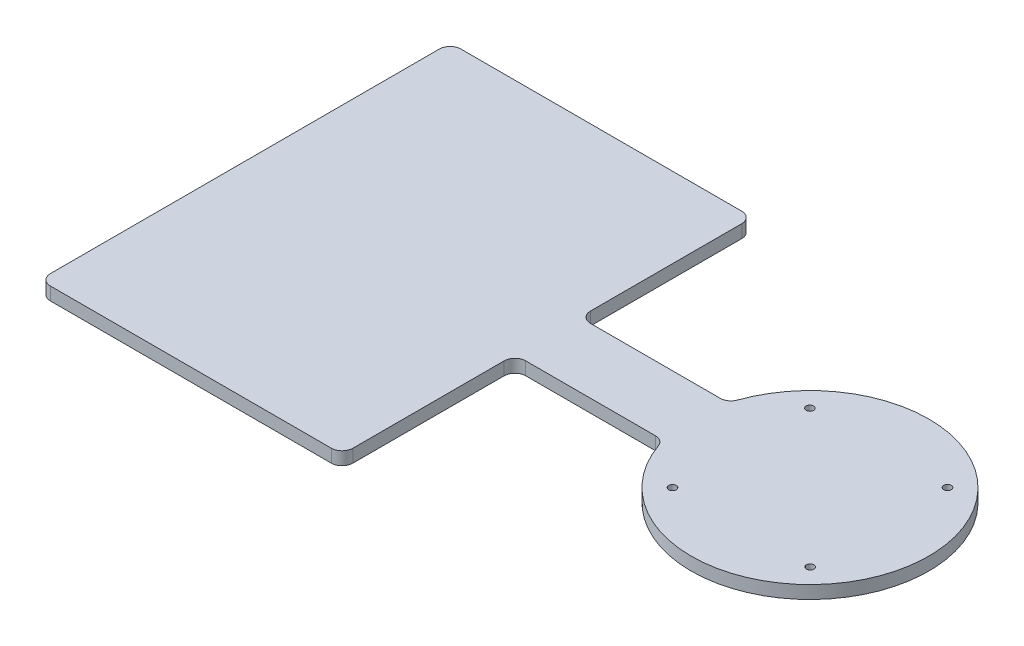
from build123d import *

# Parameters (mm, degrees)
SKETCH1_R           = 1.75
BOSS_EXTRUDE1_DEPTH = 6


with BuildPart() as part:
    # Sketch1 → Boss-Extrude1 (new body)
    with BuildSketch(Plane(origin=(0, 0, 0), x_dir=(1, 0, 0), z_dir=(0, 1, 0))):
        with BuildLine():
            Line((-56.568542495, -15), (-116.568542495, -15))
            ThreePointArc((-116.568542495, -15), (-120.104076401, -16.464466094), (-121.568542495, -20))
            Line((-121.568542495, -20), (-121.568542495, -90))
            ThreePointArc((-121.568542495, -90), (-123.033008589, -93.535533906), (-126.568542495, -95))
            Line((-126.568542495, -95), (-256.568542495, -95))
            ThreePointArc((-256.568542495, -95), (-260.104076401, -93.535533906), (-261.568542495, -90))
            Line((-261.568542495, -90), (-261.568542495, 90))
            ThreePointArc((-261.568542495, 90), (-260.104076401, 93.535533906), (-256.568542495, 95))
            Line((-256.568542495, 95), (-126.568542495, 95))
            ThreePointArc((-126.568542495, 95), (-123.033008589, 93.535533906), (-121.568542495, 90))
            Line((-121.568542495, 90), (-121.568542495, 20))
            ThreePointArc((-121.568542495, 20), (-120.104076401, 16.464466094), (-116.568542495, 15))
            Line((-116.568542495, 15), (-56.568542495, 15))
            ThreePointArc((-56.568542495, 15), (-53.681791149, 15.917517095), (-51.854497287, 18.333333333))
            ThreePointArc((-51.854497287, 18.333333333), (55, 0), (-51.854497287, -18.333333333))
            ThreePointArc((-51.854497287, -18.333333333), (-53.681791149, -15.917517095), (-56.568542495, -15))
        make_face()
        with Locations(Location((31.851272196, -31.788306962, 0), (0, 0, 270))):
            Circle(SKETCH1_R, mode=Mode.SUBTRACT)
        with Locations(Location((31.788306962, 31.851272196, 0), (0, 0, 270))):
            Circle(SKETCH1_R, mode=Mode.SUBTRACT)
        with Locations(Location((-31.851272196, 31.788306962, 0), (0, 0, 270))):
            Circle(SKETCH1_R, mode=Mode.SUBTRACT)
        with Locations(Location((-31.788306962, -31.851272196, 0), (0, 0, 270))):
            Circle(SKETCH1_R, mode=Mode.SUBTRACT)
    extrude(amount=BOSS_EXTRUDE1_DEPTH)


solid = part.part
